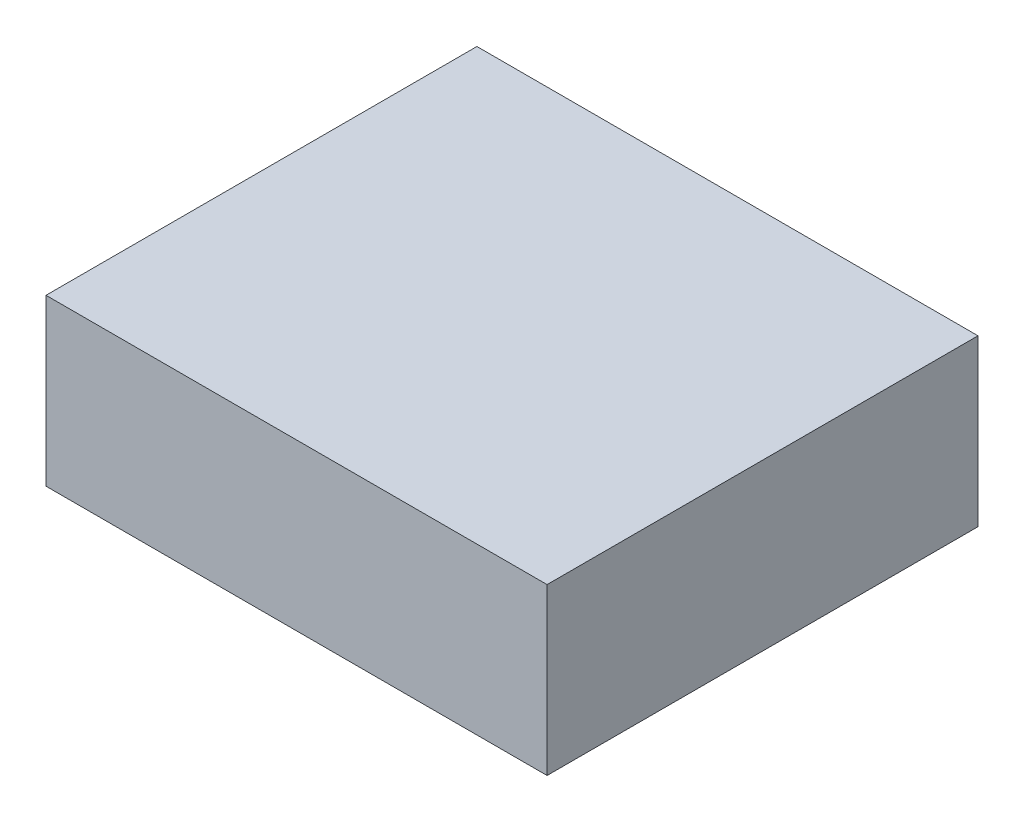
from build123d import *

# Parameters (mm, degrees)
SKETCH_1_W      = 100
SKETCH_1_H      = 86
EXTRUDE_1_DEPTH = 33


with BuildPart() as part:
    # 草图1 → 凸台-拉伸1 (new body)
    with BuildSketch(Plane(origin=(0, 0, 0), x_dir=(1, 0, 0), z_dir=(0, 1, 0))):
        with Locations((50, -43)):
            Rectangle(SKETCH_1_W, SKETCH_1_H)
    extrude(amount=EXTRUDE_1_DEPTH)


solid = part.part
